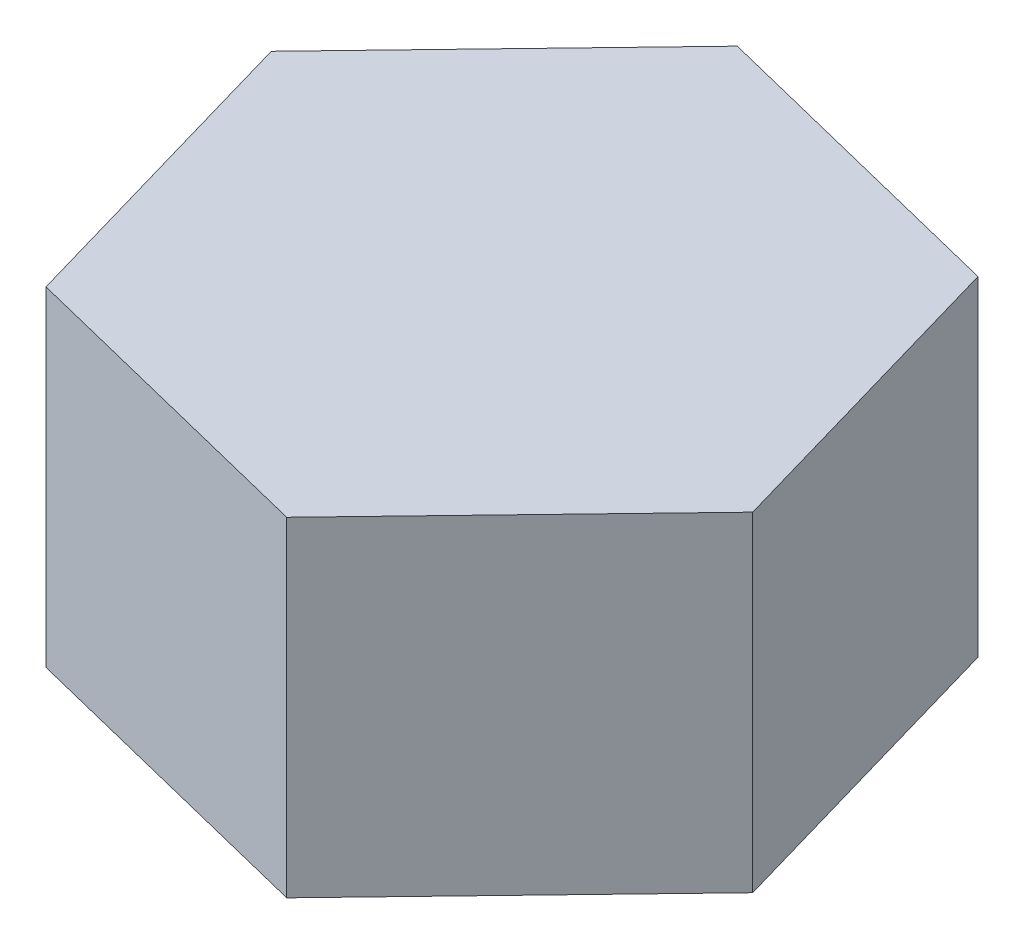
from build123d import *

# Parameters (mm, degrees)
EXTRUDE_1_DEPTH = 20


with BuildPart() as part:
    # 草图1 → 凸台-拉伸1 (new body)
    with BuildSketch(Plane(origin=(0, 0, 0), x_dir=(1, 0, 0), z_dir=(0, 1, 0))):
        Polygon((13.868668859, 14.410413737), (-5.545449945, 19.215826417), (-19.414118805, 4.805412681), (-13.868668859, -14.410413737), (5.545449945, -19.215826417), (19.414118805, -4.805412681), align=None)
    extrude(amount=EXTRUDE_1_DEPTH)


solid = part.part
